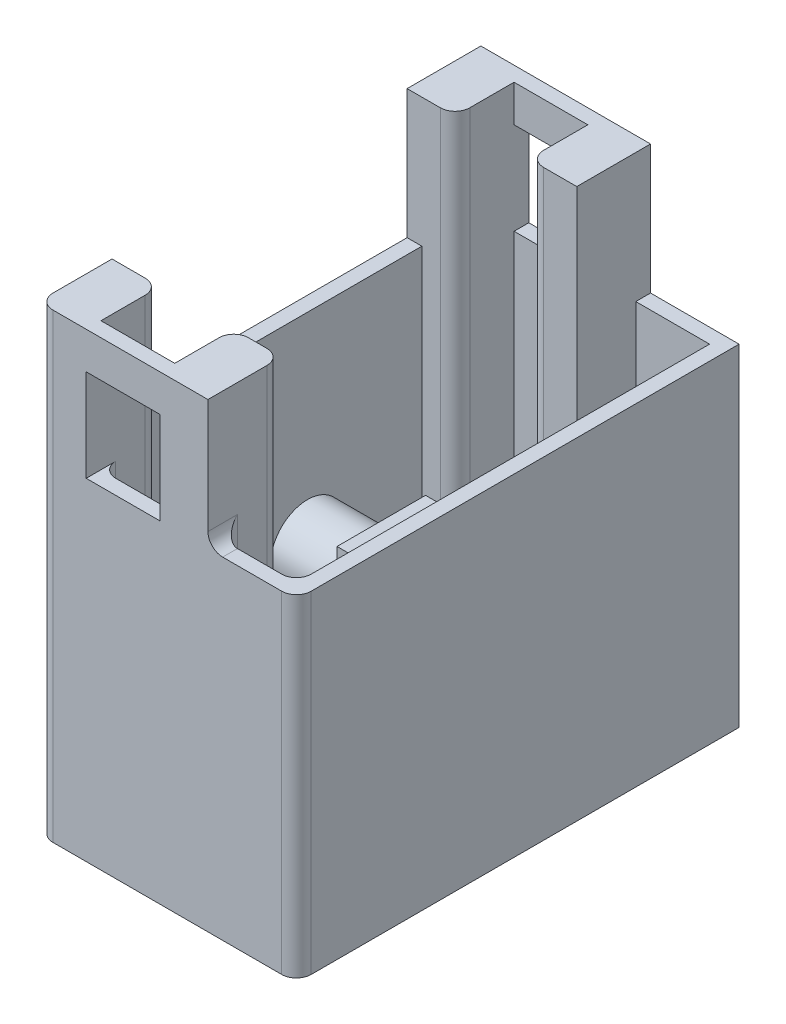
from build123d import *

# Parameters (mm, degrees)
SKETCH1_W           = 35
SKETCH1_H           = 60
SKETCH1_W_2         = 31
SKETCH1_H_2         = 56
BOSS_EXTRUDE1_DEPTH = 45
SKETCH2_W           = 30
SKETCH2_H           = 12
BOSS_EXTRUDE2_DEPTH = 16.5
SKETCH3_R           = 5
BOSS_EXTRUDE3_DEPTH = 10
SKETCH4_W           = 6.5
SKETCH4_H           = 2
BOSS_EXTRUDE4_DEPTH = 17.5
BOSS_EXTRUDE5_REACH = 73.753
SKETCH5_W           = 5
SKETCH5_H           = 2
BOSS_EXTRUDE6_REACH = 73.502
FILLET1_R           = 2


with BuildPart() as part:
    # Sketch1 → Boss-Extrude1 (new body)
    with BuildSketch(Plane(origin=(0, 0, 0), x_dir=(-1, 0, 0), z_dir=(0, 1, 0))):
        Rectangle(SKETCH1_W, SKETCH1_H)
        Rectangle(SKETCH1_W_2, SKETCH1_H_2, mode=Mode.SUBTRACT)
    extrude(amount=BOSS_EXTRUDE1_DEPTH)

    # Sketch2 → Boss-Extrude2 (add)
    with BuildSketch(Plane(origin=(15.5, 0, 0), x_dir=(0, -1, 0), z_dir=(-1, 0, 0))):
        with Locations((-15, 0)):
            Rectangle(SKETCH2_W, SKETCH2_H)
    extrude(amount=BOSS_EXTRUDE2_DEPTH)

    # Sketch3 → Boss-Extrude3 (add)
    with BuildSketch(Plane(origin=(-1, 0, 0), x_dir=(0, -1, 0), z_dir=(-1, 0, 0))):
        with Locations(Location((-22.5, 0, 0), (0, 0, 270))):
            Circle(SKETCH3_R)
    extrude(amount=BOSS_EXTRUDE3_DEPTH)

    # Sketch4 → Boss-Extrude4 (add)
    with BuildSketch(Plane(origin=(0, 45, 0), x_dir=(-1, 0, 0), z_dir=(0, 1, 0))):
        with Locations((14.25, 29)):
            Rectangle(SKETCH4_W, SKETCH4_H)
        with Locations((-2.25, 29)):
            Rectangle(SKETCH4_W, SKETCH4_H)
    boss_extrude4 = extrude(amount=BOSS_EXTRUDE4_DEPTH)

    # Sketch5 → Boss-Extrude5 (add, up to next)
    with BuildSketch(Plane(origin=(-1, 0, 0), x_dir=(0, -1, 0), z_dir=(-1, 0, 0)), mode=Mode.PRIVATE) as boss_extrude5_sk1:
        with Locations((-60, 29)):
            Rectangle(SKETCH5_W, SKETCH5_H)
    boss_extrude5_tool1 = extrude(boss_extrude5_sk1.sketch, amount=BOSS_EXTRUDE5_REACH, mode=Mode.PRIVATE) - part.part
    boss_extrude5 = boss_extrude5_tool1.solids().sort_by_distance((-1, 60, 29))[0]
    add(boss_extrude5)

    # Mirror1: Boss-Extrude4, Boss-Extrude5 across plane
    add(boss_extrude4.mirror(Plane.XY))
    add(boss_extrude5.mirror(Plane.XY))

    # Boss-Extrude6: up to this face of the body (flat: up to its plane)
    boss_extrude6_end = Plane(part.part.faces().sort_by_distance((2.554270463, 0, 0))[0])
    # Sketch7 → Boss-Extrude6 (add, up to the picked face)
    with BuildSketch(Plane(origin=(0, 62.5, 0), x_dir=(-1, 0, 0), z_dir=(0, 1, 0)), mode=Mode.PRIVATE) as boss_extrude6_sk1:
        with BuildLine():
            Line((11, 30), (17.5, 30))
            Line((17.5, 30), (17.5, 20))
            Line((17.5, 20), (13, 20))
            ThreePointArc((13, 20), (11.585786438, 20.585786438), (11, 22))
            Line((11, 22), (11, 30))
        make_face()
    boss_extrude6_tool1 = split(extrude(boss_extrude6_sk1.sketch, amount=-BOSS_EXTRUDE6_REACH, mode=Mode.PRIVATE), bisect_by=boss_extrude6_end, keep=Keep.BOTH, mode=Mode.PRIVATE)
    # Sketch7 → Boss-Extrude6 (add, up to the picked face)
    with BuildSketch(Plane(origin=(0, 62.5, 0), x_dir=(-1, 0, 0), z_dir=(0, 1, 0)), mode=Mode.PRIVATE) as boss_extrude6_sk2:
        with BuildLine():
            Line((-5.5, 30), (1, 30))
            Line((1, 30), (1, 22))
            ThreePointArc((1, 22), (0.414213562, 20.585786438), (-1, 20))
            Line((-1, 20), (-5.5, 20))
            Line((-5.5, 20), (-5.5, 30))
        make_face()
    boss_extrude6_tool2 = split(extrude(boss_extrude6_sk2.sketch, amount=-BOSS_EXTRUDE6_REACH, mode=Mode.PRIVATE), bisect_by=boss_extrude6_end, keep=Keep.BOTH, mode=Mode.PRIVATE)
    boss_extrude6_1 = boss_extrude6_tool1.solids().sort_by(Axis((-14.287516, 62.5, 25.060936), (0, -1, 0)))[0]
    add(boss_extrude6_1)
    boss_extrude6_2 = boss_extrude6_tool2.solids().sort_by(Axis((2.287516, 62.5, 25.060936), (0, -1, 0)))[0]
    add(boss_extrude6_2)
    boss_extrude6 = boss_extrude6_1 + boss_extrude6_2  # Boss-Extrude6 as one shape, for the pattern or mirror that repeats it

    # Fillet1
    fillet1_edges = [part.edges().sort_by_distance(p)[0] for p in [
        (-15.5, 22.5, 20),
        (-16.5, 45, 20),
        (-11, 22.5, 28),
        (-1, 22.5, 28),
        (5.5, 22.5, 28),
        (5.5, 31.25, 20),
        (15.5, 22.5, 28),
        (5.5, 45, 29),
        (17.5, 22.5, 30),
        (-17.5, 31.25, 30),
    ]]
    fillet(fillet1_edges, radius=FILLET1_R)

    # Mirror2: Boss-Extrude4, Boss-Extrude5, Boss-Extrude6 across plane
    add(boss_extrude4.mirror(Plane.XY))
    add(boss_extrude5.mirror(Plane.XY))
    add(boss_extrude6.mirror(Plane.XY))


solid = part.part
